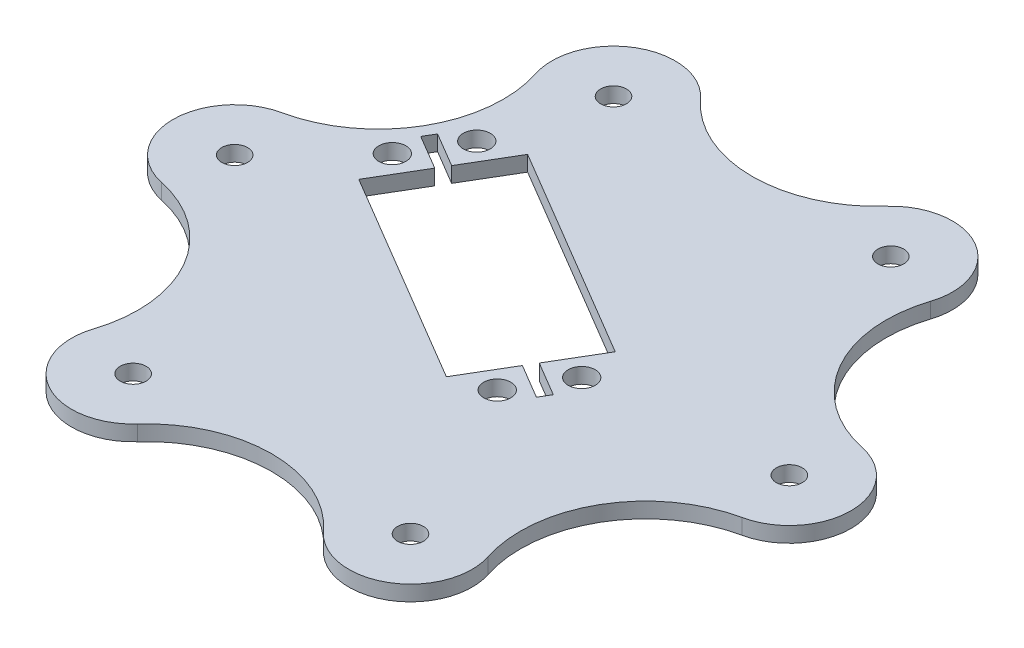
from build123d import *

# Parameters (mm, degrees)
SKETCH_2_R          = 6.5
EXTRUDE_1_DEPTH     = 2.5
SKETCH_3_R          = 2.1
CUT_EXTRUDE_1_DEPTH = 2.5
CUT_EXTRUDE_2_DEPTH = 10
SKETCH_5_R          = 2.2
CUT_EXTRUDE_3_DEPTH = 10
CUT_EXTRUDE_4_DEPTH = 10


with BuildPart() as part:
    # 草图2 → 凸台-拉伸1 (new body)
    with BuildSketch(Plane(origin=(0, 0, 0), x_dir=(1, 0, 0), z_dir=(0, 1, 0))):
        with BuildLine():
            ThreePointArc((-47.091925455, 9.778744699), (-55, -1.253e-06), (-47.091923006, -9.778745223))
            ThreePointArc((-47.091923006, -9.778745223), (-33.750000065, -19.485571473), (-32.014603203, -35.893428778))
            ThreePointArc((-32.014603203, -35.893428778), (-27.500000081, -47.631397162), (-15.077319674, -45.672174193))
            ThreePointArc((-15.077319674, -45.672174193), (-9.8e-08, -38.97114317), (15.077319542, -45.672174048))
            ThreePointArc((15.077319542, -45.672174048), (27.500000118, -47.63139714), (32.014603117, -35.893428511))
            ThreePointArc((32.014603117, -35.893428511), (33.750000078, -19.485571451), (47.091922781, -9.778745271))
            ThreePointArc((47.091922781, -9.778745271), (55, -2.05e-07), (47.091923183, 9.778745185))
            ThreePointArc((47.091923183, 9.778745185), (33.750000105, 19.485571404), (32.01460321, 35.893428798))
            ThreePointArc((32.01460321, 35.893428798), (27.499999984, 47.631397217), (15.077319539, 45.672174044))
            ThreePointArc((15.077319539, 45.672174044), (1.8e-08, 38.97114317), (-15.077319515, 45.672174018))
            ThreePointArc((-15.077319515, 45.672174018), (-27.5000001, 47.63139715), (-32.014603117, 35.893428511))
            ThreePointArc((-32.014603117, 35.893428511), (-33.750000761, 19.485570266), (-47.091925455, 9.778744699))
        make_face()
        with Locations(Location((0, 0, 0), (0, 0, 270))):
            Circle(SKETCH_2_R, mode=Mode.SUBTRACT)
    extrude(amount=EXTRUDE_1_DEPTH)

    # 草图3 → 切除-拉伸1 (cut)
    with BuildSketch(Plane(origin=(0, 2.5, 0), x_dir=(1, 0, 0), z_dir=(0, 1, 0))):
        with Locations(Location((-22.5, 38.97114317, 0), (0, 0, 270))):
            Circle(SKETCH_3_R)
        with Locations(Location((22.5, 38.97114317, 0), (0, 0, 270))):
            Circle(SKETCH_3_R)
        with Locations(Location((45, 0, 0), (0, 0, 270))):
            Circle(SKETCH_3_R)
        with Locations(Location((22.5, -38.97114317, 0), (0, 0, 270))):
            Circle(SKETCH_3_R)
        with Locations(Location((-22.5, -38.97114317, 0), (0, 0, 270))):
            Circle(SKETCH_3_R)
        with Locations(Location((-45, 0, 0), (0, 0, 270))):
            Circle(SKETCH_3_R)
    extrude(amount=-CUT_EXTRUDE_1_DEPTH, mode=Mode.SUBTRACT)

    # 草图4 → 切除-拉伸2 (cut)
    with BuildSketch(Plane(origin=(0, 2.5, 0), x_dir=(1, 0, 0), z_dir=(0, 1, 0))):
        Polygon((-21.320889551, 23.855935356), (13.529450533, 3.223344728), (3.340516889, -13.986699758), (-31.509823195, 6.64589087), align=None)
    extrude(amount=-CUT_EXTRUDE_2_DEPTH, mode=Mode.SUBTRACT)

    # 草图5 → 切除-拉伸3 (cut)
    with BuildSketch(Plane(origin=(0, 2.5, 0), x_dir=(1, 0, 0), z_dir=(0, 1, 0))):
        with Locations(Location((14.424226019, -3.116953122, 0), (0, 0, 270))):
            Circle(SKETCH_5_R)
        with Locations(Location((9.329759197, -11.721975365, 0), (0, 0, 270))):
            Circle(SKETCH_5_R)
        with Locations(Location((-27.310131859, 21.591210963, 0), (0, 0, 270))):
            Circle(SKETCH_5_R)
        with Locations(Location((-32.404598681, 12.98618872, 0), (0, 0, 270))):
            Circle(SKETCH_5_R)
    extrude(amount=-CUT_EXTRUDE_3_DEPTH, mode=Mode.SUBTRACT)

    # 草图6 → 切除-拉伸4 (cut)
    with BuildSketch(Plane(origin=(0, 2.5, 0), x_dir=(1, 0, 0), z_dir=(0, 1, 0))):
        Polygon((-32.518067513, 17.701814323), (-31.499174149, 19.422818771), (14.537694851, -7.832578725), (13.518801487, -9.553583174), align=None)
    extrude(amount=-CUT_EXTRUDE_4_DEPTH, mode=Mode.SUBTRACT)


solid = part.part
